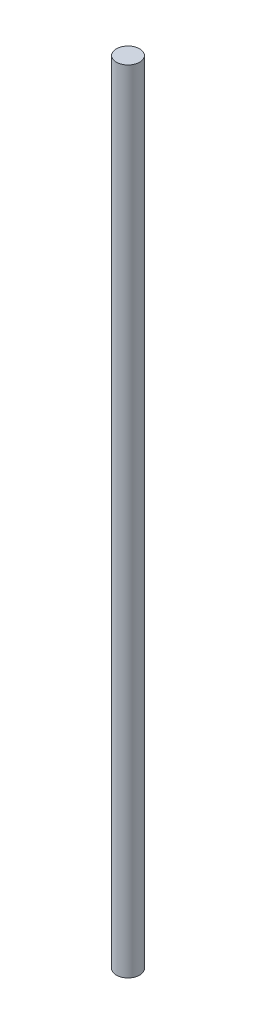
from build123d import *

# Parameters (mm, degrees)
SKETCH1_R           = 5
BOSS_EXTRUDE1_DEPTH = 300
BOSS_EXTRUDE2_START = 20
SKETCH2_R           = 5
BOSS_EXTRUDE2_DEPTH = 20
SKETCH3_R           = 5
BOSS_EXTRUDE3_DEPTH = 20


with BuildPart() as part:
    # Sketch1 → Boss-Extrude1 (new body)
    with BuildSketch(Plane(origin=(0, 0, 0), x_dir=(1, 0, 0), z_dir=(0, 1, 0))):
        with Locations(Location((0, 0, 0), (0, 0, 270))):
            Circle(SKETCH1_R)
    extrude(amount=BOSS_EXTRUDE1_DEPTH)

    # Sketch2 → Boss-Extrude2 (add)
    with BuildSketch(Plane.XZ.offset(BOSS_EXTRUDE2_START)):
        with Locations(Location((0, 0, 0), (0, 0, 270))):
            Circle(SKETCH2_R)
    extrude(amount=-BOSS_EXTRUDE2_DEPTH)

    # Sketch3 → Boss-Extrude3 (add)
    with BuildSketch(Plane(origin=(0, 300, 0), x_dir=(1, 0, 0), z_dir=(0, 1, 0))):
        with Locations(Location((0, 0, 0), (0, 0, 90))):
            Circle(SKETCH3_R)
    extrude(amount=BOSS_EXTRUDE3_DEPTH)


solid = part.part
